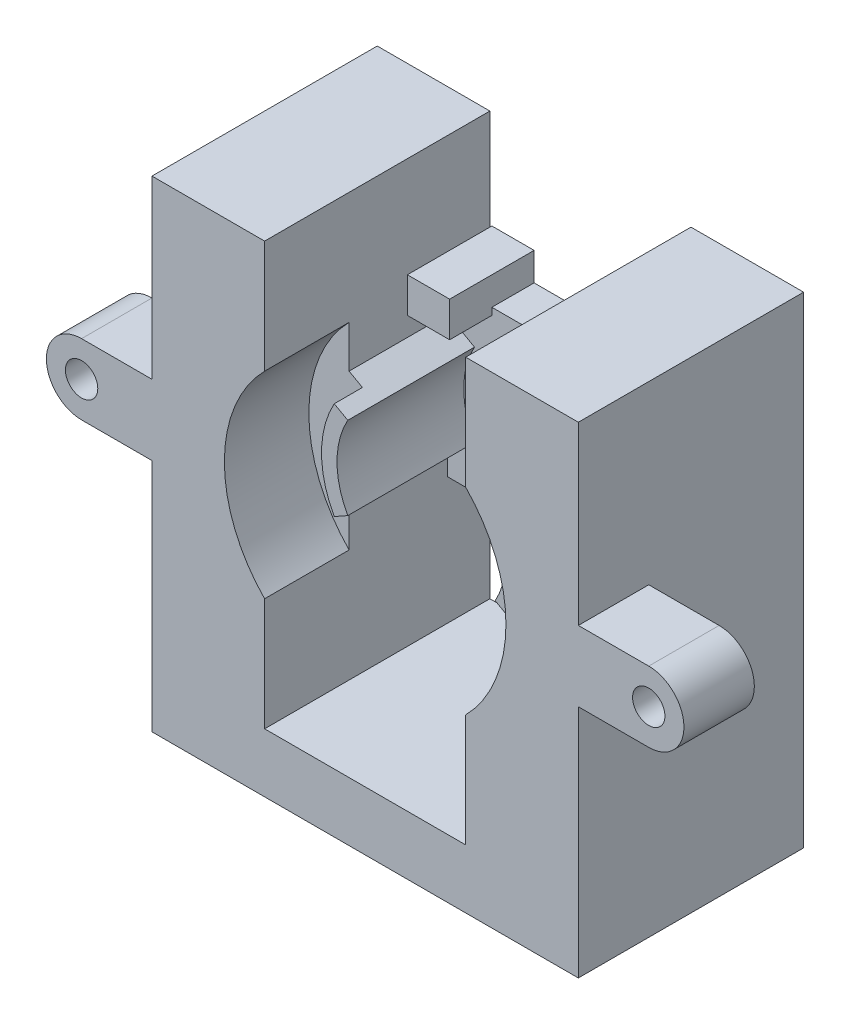
from build123d import *

# Parameters (mm, degrees)
EXTRUDE_2_DEPTH     = 16
SKETCH_1_3_R        = 2.6
EXTRUDE_3_DEPTH     = 3
EXTRUDE_START       = 16
SKETCH_1_6_R        = 1.15
EXTRUDE_4_DEPTH     = 5
CUT_EXTRUDE_START   = 10
CUT_EXTRUDE_1_DEPTH = 13
CUT_EXTRUDE_START_2 = 12
CUT_EXTRUDE_2_DEPTH = 13
SKETCH_3_R          = 1.05
EXTRUDE_5_DEPTH     = 6
EXTRUDE_START_2     = -3
SKETCH_4_W          = 3
SKETCH_4_H          = 2.5
EXTRUDE_7_DEPTH     = 6


with BuildPart() as part:
    # 草图1 → 凸台-拉伸2 (new body)
    with BuildSketch(Plane.XY):
        with BuildLine():
            ThreePointArc((-7.141428429, 7), (-10, 0), (-7.141428429, -7))
            Line((-7.141428429, -7), (-7.141428429, -15))
            Line((-7.141428429, -15), (-4, -15))
            Line((-4, -15), (4, -15))
            Line((4, -15), (7.141428429, -15))
            Line((7.141428429, -15), (7.141428429, -7))
            ThreePointArc((7.141428429, -7), (10, 0), (7.141428429, 7))
            Line((7.141428429, 7), (7.141428429, 15))
            Line((7.141428429, 15), (15.141428429, 15))
            Line((15.141428429, 15), (15.141428429, -19.186046512))
            Line((15.141428429, -19.186046512), (-15.141428429, -19.186046512))
            Line((-15.141428429, -19.186046512), (-15.141428429, 15))
            Line((-15.141428429, 15), (-7.141428429, 15))
            Line((-7.141428429, 15), (-7.141428429, 7))
        make_face()
        with BuildLine():
            Line((-7.141428429, 4), (-7.141428429, 6))
            Line((-7.141428429, 6), (-7.141428429, 7))
            ThreePointArc((-7.141428429, 7), (-10, 0), (-7.141428429, -7))
            Line((-7.141428429, -7), (-7.141428429, -6))
            Line((-7.141428429, -6), (-7.141428429, -4))
            Line((-7.141428429, -4), (-6.194496835, -3.46961222))
            ThreePointArc((-6.194496835, -3.46961222), (-7.1, 0), (-6.194496835, 3.46961222))
            Line((-6.194496835, 3.46961222), (-7.141428429, 4))
        make_face()
        with BuildLine():
            Line((-5.234786058, 2.932066665), (-6.194496835, 3.46961222))
            ThreePointArc((-6.194496835, 3.46961222), (-7.1, 0), (-6.194496835, -3.46961222))
            Line((-6.194496835, -3.46961222), (-5.234786058, -2.932066665))
            ThreePointArc((-5.234786058, -2.932066665), (-6, 0), (-5.234786058, 2.932066665))
        make_face()
        with BuildLine():
            ThreePointArc((6.194496835, -3.46961222), (7.1, 0), (6.194496835, 3.46961222))
            Line((6.194496835, 3.46961222), (5.234786058, 2.932066665))
            ThreePointArc((5.234786058, 2.932066665), (6, 0), (5.234786058, -2.932066665))
            Line((5.234786058, -2.932066665), (6.194496835, -3.46961222))
        make_face()
        with BuildLine():
            ThreePointArc((7.141428429, -7), (10, 0), (7.141428429, 7))
            Line((7.141428429, 7), (7.141428429, 6))
            Line((7.141428429, 6), (7.141428429, 4))
            Line((7.141428429, 4), (6.194496835, 3.46961222))
            ThreePointArc((6.194496835, 3.46961222), (7.1, 0), (6.194496835, -3.46961222))
            Line((6.194496835, -3.46961222), (7.141428429, -4))
            Line((7.141428429, -4), (7.141428429, -6))
            Line((7.141428429, -6), (7.141428429, -7))
        make_face()
    extrude(amount=EXTRUDE_2_DEPTH)

    # 草图1<3> → 凸台-拉伸3 (add)
    with BuildSketch(Plane.XY):
        with BuildLine():
            Line((7.141428429, 4), (7.141428429, 6))
            Line((7.141428429, 6), (-7.141428429, 6))
            Line((-7.141428429, 6), (-7.141428429, 4))
            Line((-7.141428429, 4), (-6.194496835, 3.46961222))
            Line((-6.194496835, 3.46961222), (-5.234786058, 2.932066665))
            ThreePointArc((-5.234786058, 2.932066665), (-6, 0), (-5.234786058, -2.932066665))
            Line((-5.234786058, -2.932066665), (-6.194496835, -3.46961222))
            Line((-6.194496835, -3.46961222), (-7.141428429, -4))
            Line((-7.141428429, -4), (-7.141428429, -6))
            Line((-7.141428429, -6), (7.141428429, -6))
            Line((7.141428429, -6), (7.141428429, -4))
            Line((7.141428429, -4), (6.194496835, -3.46961222))
            Line((6.194496835, -3.46961222), (5.234786058, -2.932066665))
            ThreePointArc((5.234786058, -2.932066665), (6, 0), (5.234786058, 2.932066665))
            Line((5.234786058, 2.932066665), (6.194496835, 3.46961222))
            Line((6.194496835, 3.46961222), (7.141428429, 4))
        make_face()
        Circle(SKETCH_1_3_R, mode=Mode.SUBTRACT)
    extrude(amount=EXTRUDE_3_DEPTH)

    # 草图1<6> → 凸台-拉伸4 (add)
    # profile 1 of 2: a face of its own
    with BuildSketch(Plane.XY.offset(EXTRUDE_START)):
        with BuildLine():
            Line((-15.141428429, -2.5), (-15.141428429, 2.5))
            Line((-15.141428429, 2.5), (-20.141428429, 2.5))
            ThreePointArc((-20.141428429, 2.5), (-22.641428429, 0), (-20.141428429, -2.5))
            Line((-20.141428429, -2.5), (-15.141428429, -2.5))
        make_face()
        with Locations((-20.141428429, 0)):
            Circle(SKETCH_1_6_R, mode=Mode.SUBTRACT)
    # profile 2 of 2: a face of its own
    with BuildSketch(Plane.XY.offset(EXTRUDE_START)):
        with BuildLine():
            Line((20.141428429, 2.5), (15.141428429, 2.5))
            Line((15.141428429, 2.5), (15.141428429, -2.5))
            Line((15.141428429, -2.5), (20.141428429, -2.5))
            ThreePointArc((20.141428429, -2.5), (22.641428429, 0), (20.141428429, 2.5))
        make_face()
        with Locations((20.141428429, 0)):
            Circle(SKETCH_1_6_R, mode=Mode.SUBTRACT)
    extrude(amount=-EXTRUDE_4_DEPTH)

    # 草图1<4> → 切除-拉伸1 (cut)
    with BuildSketch(Plane.XY.offset(CUT_EXTRUDE_START)):
        with BuildLine():
            Line((-7.141428429, 4), (-7.141428429, 6))
            Line((-7.141428429, 6), (-7.141428429, 7))
            ThreePointArc((-7.141428429, 7), (-10, 0), (-7.141428429, -7))
            Line((-7.141428429, -7), (-7.141428429, -6))
            Line((-7.141428429, -6), (-7.141428429, -4))
            Line((-7.141428429, -4), (-6.194496835, -3.46961222))
            ThreePointArc((-6.194496835, -3.46961222), (-7.1, 0), (-6.194496835, 3.46961222))
            Line((-6.194496835, 3.46961222), (-7.141428429, 4))
        make_face()
        with BuildLine():
            ThreePointArc((7.141428429, -7), (10, 0), (7.141428429, 7))
            Line((7.141428429, 7), (7.141428429, 6))
            Line((7.141428429, 6), (7.141428429, 4))
            Line((7.141428429, 4), (6.194496835, 3.46961222))
            ThreePointArc((6.194496835, 3.46961222), (7.1, 0), (6.194496835, -3.46961222))
            Line((6.194496835, -3.46961222), (7.141428429, -4))
            Line((7.141428429, -4), (7.141428429, -6))
            Line((7.141428429, -6), (7.141428429, -7))
        make_face()
    extrude(amount=CUT_EXTRUDE_1_DEPTH, mode=Mode.SUBTRACT)

    # 草图1<5> → 切除-拉伸2 (cut)
    with BuildSketch(Plane.XY.offset(CUT_EXTRUDE_START_2)):
        with BuildLine():
            Line((-5.234786058, 2.932066665), (-6.194496835, 3.46961222))
            ThreePointArc((-6.194496835, 3.46961222), (-7.1, 0), (-6.194496835, -3.46961222))
            Line((-6.194496835, -3.46961222), (-5.234786058, -2.932066665))
            ThreePointArc((-5.234786058, -2.932066665), (-6, 0), (-5.234786058, 2.932066665))
        make_face()
        with BuildLine():
            ThreePointArc((6.194496835, -3.46961222), (7.1, 0), (6.194496835, 3.46961222))
            Line((6.194496835, 3.46961222), (5.234786058, 2.932066665))
            ThreePointArc((5.234786058, 2.932066665), (6, 0), (5.234786058, -2.932066665))
            Line((5.234786058, -2.932066665), (6.194496835, -3.46961222))
        make_face()
    extrude(amount=CUT_EXTRUDE_2_DEPTH, mode=Mode.SUBTRACT)

    # 草图3 → 凸台-拉伸5 (add)
    with BuildSketch(Plane(origin=(0, 0, 0), x_dir=(-1, 0, 0), z_dir=(0, 0, -1))):
        with Locations((0, 6)):
            Circle(SKETCH_3_R)
    extrude(amount=-EXTRUDE_5_DEPTH)

    # 草图4 → 凸台-拉伸7 (add)
    with BuildSketch(Plane.XY.offset(3).offset(EXTRUDE_START_2)):
        with Locations((5.5, 6.75)):
            Rectangle(SKETCH_4_W, SKETCH_4_H)
        with Locations((-5.5, 6.75)):
            Rectangle(SKETCH_4_W, SKETCH_4_H)
    extrude(amount=EXTRUDE_7_DEPTH)


solid = part.part
